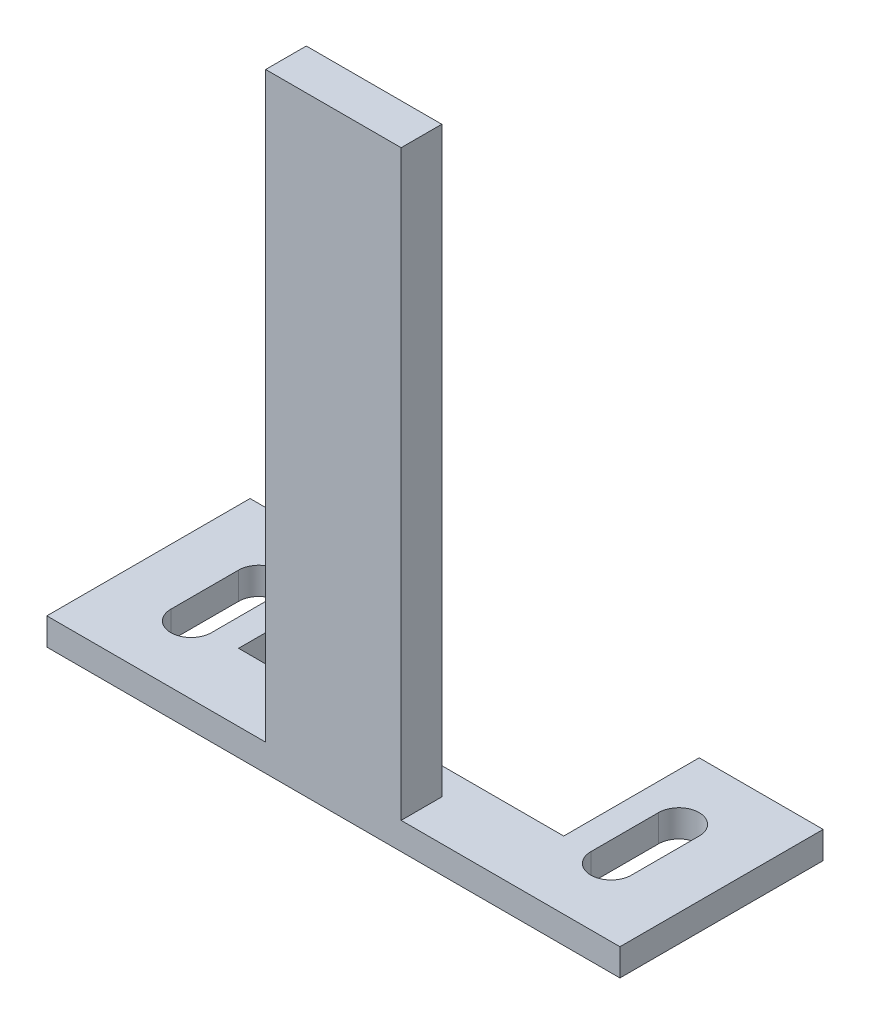
from build123d import *

# Parameters (mm, degrees)
DODANIE_WYCI_GNI_CIE1_DEPTH = 2
SZKIC4_W                    = 10
SZKIC4_H                    = 45
DODANIE_WYCI_GNI_CIE2_DEPTH = 3


with BuildPart() as part:
    # Szkic1 → Dodanie-wyciągnięcie1 (new body)
    with BuildSketch(Plane(origin=(0, 0, 0), x_dir=(1, 0, 0), z_dir=(0, 1, 0))):
        Polygon((-21.15, 7.5), (-12, 7.5), (-12, -2.5), (12, -2.5), (12, 7.5), (21.15, 7.5), (21.15, -7.5), (-21.15, -7.5), align=None)
        with BuildLine():
            Line((-14, 2.5), (-14, -2.5))
            ThreePointArc((-14, -2.5), (-15.5, -4), (-17, -2.5))
            Line((-17, -2.5), (-17, 2.5))
            ThreePointArc((-17, 2.5), (-15.5, 4), (-14, 2.5))
        make_face(mode=Mode.SUBTRACT)
        with BuildLine():
            Line((17, 2.5), (17, -2.5))
            ThreePointArc((17, -2.5), (15.5, -4), (14, -2.5))
            Line((14, -2.5), (14, 2.5))
            ThreePointArc((14, 2.5), (15.5, 4), (17, 2.5))
        make_face(mode=Mode.SUBTRACT)
    extrude(amount=DODANIE_WYCI_GNI_CIE1_DEPTH)

    # Szkic4 → Dodanie-wyciągnięcie2 (add)
    with BuildSketch(Plane.XY.offset(7.5)):
        with Locations((0, 22.5)):
            Rectangle(SZKIC4_W, SZKIC4_H)
    extrude(amount=-DODANIE_WYCI_GNI_CIE2_DEPTH)


solid = part.part
